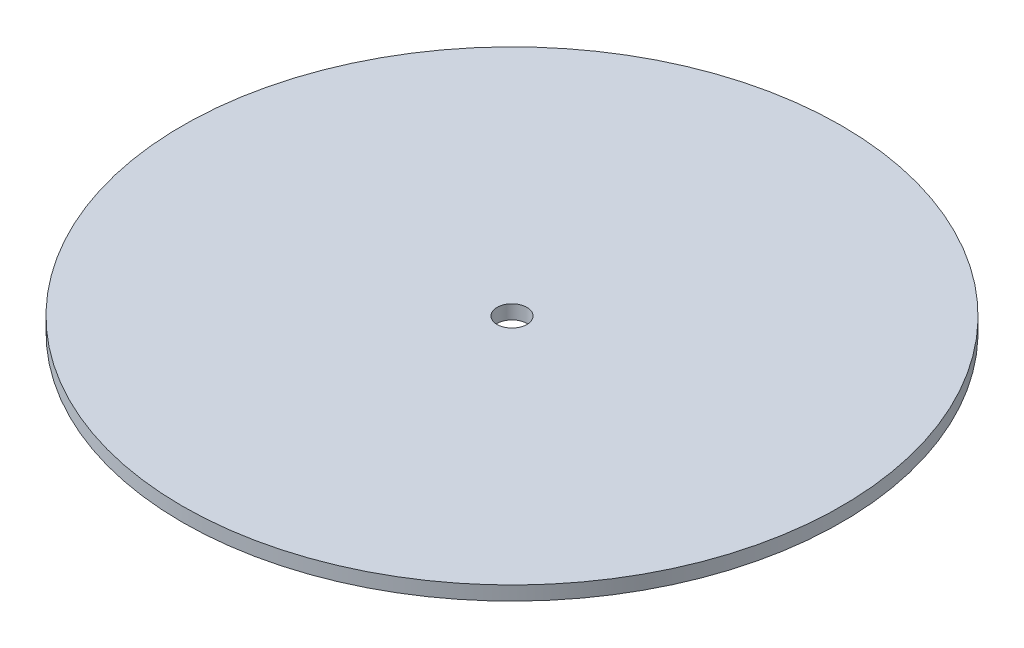
from build123d import *

# Parameters (mm, degrees)
SKETCH1_R               = 74.7776
BOSS_EXTRUDE1_DEPTH     = 3.175
F_1_4_CLEARANCE_HOLE1_D = 6.7564


with BuildPart() as part:
    # Sketch1 → Boss-Extrude1 (new body)
    with BuildSketch(Plane(origin=(0, 0, 0), x_dir=(1, 0, 0), z_dir=(0, 1, 0))):
        with Locations(Location((0, 0, 0), (0, 0, 270))):
            Circle(SKETCH1_R)
    extrude(amount=BOSS_EXTRUDE1_DEPTH)

    # 1/4 Clearance Hole1 (through all)
    with Locations(Plane(origin=(0, 3.175, 0), x_dir=(1, 0, 0), z_dir=(0, 1, 0))):
        with Locations((0, 0)):
            Hole(F_1_4_CLEARANCE_HOLE1_D / 2)


solid = part.part
